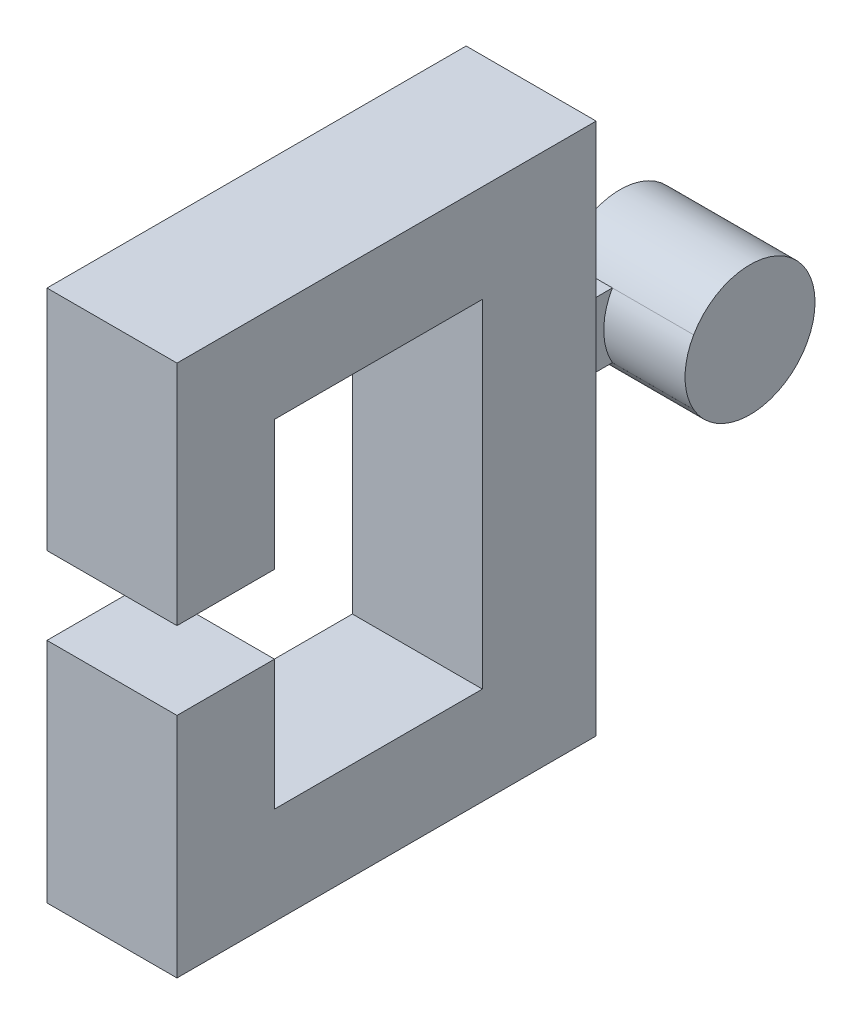
from build123d import *

# Parameters (mm, degrees)
BOSS_EXTRUDE1_DEPTH = 25.4
CUT_EXTRUDE1_DEPTH  = 15.875


with BuildPart() as part:
    # Sketch1 → Boss-Extrude1 (new body)
    with BuildSketch(Plane.YZ):
        with BuildLine():
            Line((0, 0), (44.4246, 0))
            Line((44.4246, 0), (44.4246, -19.05))
            Line((44.4246, -19.05), (19.05, -19.05))
            Line((19.05, -19.05), (19.05, -59.6646))
            Line((19.05, -59.6646), (84.9884, -59.6646))
            Line((84.9884, -59.6646), (84.9884, -19.05))
            Line((84.9884, -19.05), (59.6138, -19.05))
            Line((59.6138, -19.05), (59.6138, 0))
            Line((59.6138, 0), (104.0384, 0))
            Line((104.0384, 0), (104.0384, -81.8896))
            Line((104.0384, -81.8896), (58.34888, -81.8896))
            Line((58.34888, -81.8896), (58.34888, -100.9396))
            ThreePointArc((58.34888, -100.9396), (52.013341911, -124.649828033), (45.69968, -100.933765343))
            Line((45.69968, -100.933765343), (45.69968, -81.8896))
            Line((45.69968, -81.8896), (0, -81.8896))
            Line((0, -81.8896), (0, 0))
        make_face()
    extrude(amount=BOSS_EXTRUDE1_DEPTH)

    # Sketch2 → Cut-Extrude1 (cut)
    with BuildSketch(Plane.YZ.offset(25.4)):
        with BuildLine():
            Line((45.69968, -81.8896), (58.34888, -81.8896))
            Line((58.34888, -81.8896), (58.34888, -100.9396))
            ThreePointArc((58.34888, -100.9396), (52.02428, -99.251185541), (45.69968, -100.9396))
            Line((45.69968, -100.9396), (45.69968, -81.8896))
        make_face()
    extrude(amount=-CUT_EXTRUDE1_DEPTH, mode=Mode.SUBTRACT)


solid = part.part
